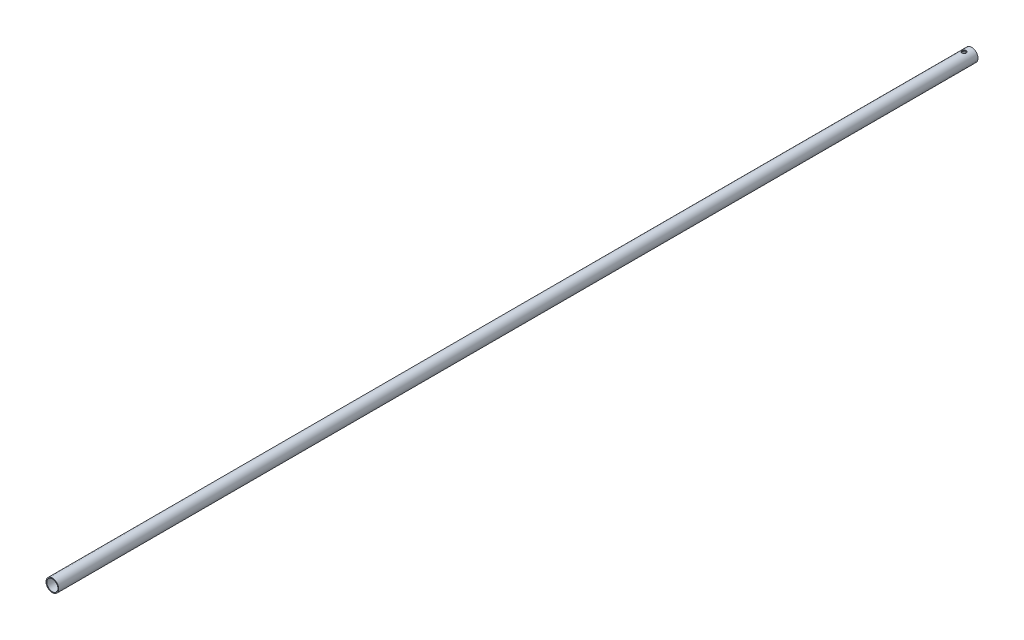
from build123d import *

# Parameters (mm, degrees)
SKETCH1_R               = 19.05
SKETCH1_R_2             = 16.51
BOSS_EXTRUDE1_DEPTH     = 2743.2
CUT_EXTRUDE1_DEPTH      = 2744.332288477
CUT_EXTRUDE1_DEPTH_BACK = 2744.332288477
SKETCH2_R               = 6.35


with BuildPart() as part:
    # Sketch1 → Boss-Extrude1 (new body)
    with BuildSketch(Plane.XY):
        Circle(SKETCH1_R)
        Circle(SKETCH1_R_2, mode=Mode.SUBTRACT)
    extrude(amount=BOSS_EXTRUDE1_DEPTH)

    # Sketch2 → Cut-Extrude1 (cut, two sides: drawn at the far end of the back side and taken through both)
    with BuildSketch(Plane(origin=(0, 0, 0), x_dir=(1, 0, 0), z_dir=(0, 1, 0)).offset(-CUT_EXTRUDE1_DEPTH_BACK)):
        with Locations(Location((0, -22.86, 0), (0, 0, 270))):
            Circle(SKETCH2_R)
    extrude(amount=CUT_EXTRUDE1_DEPTH + CUT_EXTRUDE1_DEPTH_BACK, mode=Mode.SUBTRACT)


solid = part.part
